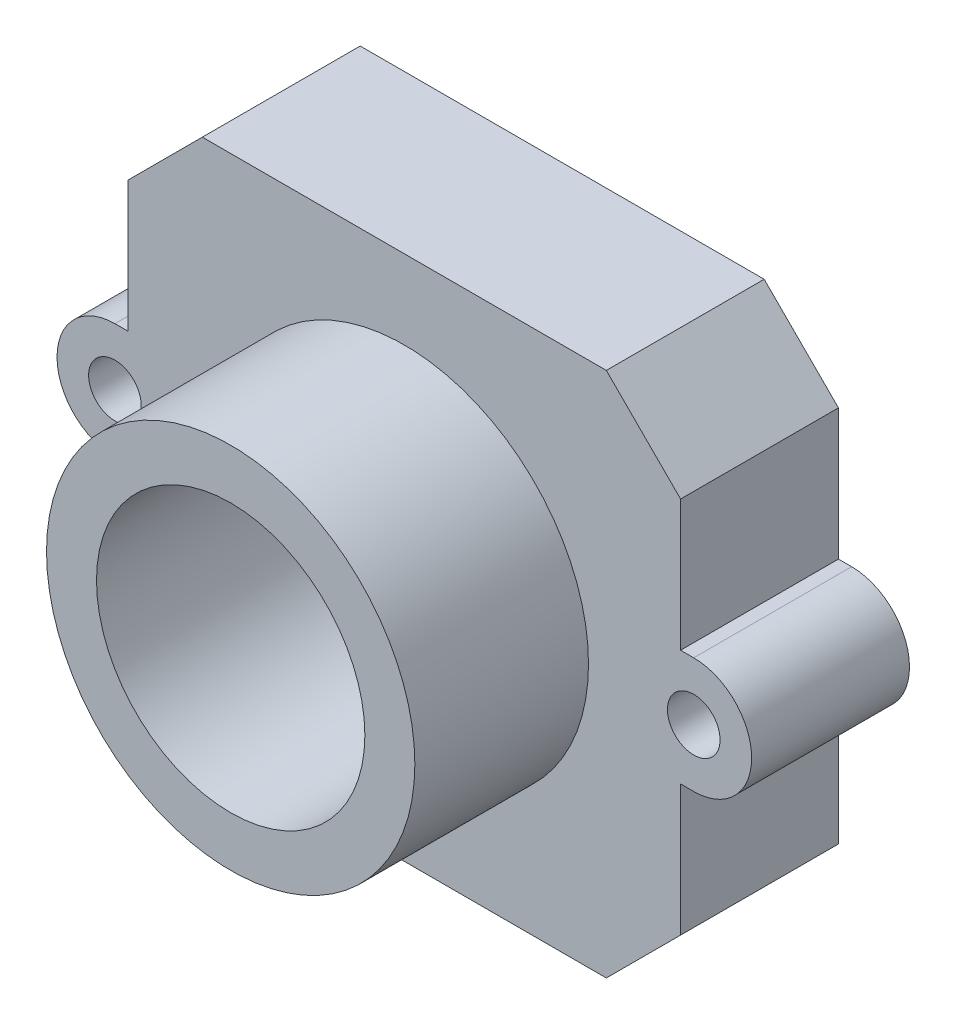
from build123d import *

# Parameters (mm, degrees)
SKETCH1_R                = 1
ROOF_DEPTH               = 1
WALLS_START              = -5
SKETCH1_3_R              = 1
WALLS_DEPTH              = 5
SKETCH2_R                = 5.1
SCREW_HOLE_IN_ROOF_DEPTH = 18.613631253
SCREW_START              = 6.6
SKETCH2_3_R              = 7
SKETCH2_3_R_2            = 5.1
SCREW_HOLDER_DEPTH       = 6.6


with BuildPart() as part:
    # Sketch1 → Roof (new body)
    with BuildSketch(Plane.XY):
        with BuildLine():
            Line((-7.67766953, 10), (-10.5, 7.17766953))
            Line((-10.5, 7.17766953), (-10.5, 2.2))
            Line((-10.5, 2.2), (-11.000000224, 2.2))
            ThreePointArc((-11.000000224, 2.2), (-13.200000224, 0), (-11.000000224, -2.2))
            Line((-11.000000224, -2.2), (-10.5, -2.2))
            Line((-10.5, -2.2), (-10.5, -7.17766953))
            Line((-10.5, -7.17766953), (-7.67766953, -10))
            Line((-7.67766953, -10), (7.67766953, -10))
            Line((7.67766953, -10), (10.5, -7.17766953))
            Line((10.5, -7.17766953), (10.5, -2.2))
            Line((10.5, -2.2), (11, -2.2))
            ThreePointArc((11, -2.2), (13.2, 0), (11, 2.2))
            Line((11, 2.2), (10.5, 2.2))
            Line((10.5, 2.2), (10.5, 7.17766953))
            Line((10.5, 7.17766953), (7.67766953, 10))
            Line((7.67766953, 10), (-7.67766953, 10))
        make_face()
        with Locations((11, 0)):
            Circle(SKETCH1_R, mode=Mode.SUBTRACT)
        with Locations((-11.000000224, 0)):
            Circle(SKETCH1_R, mode=Mode.SUBTRACT)
    extrude(amount=ROOF_DEPTH)

    # Sketch1<3> → Walls (add)
    with BuildSketch(Plane.XY.offset(WALLS_START)):
        with BuildLine():
            Line((-7.67766953, 10), (-10.5, 7.17766953))
            Line((-10.5, 7.17766953), (-10.5, 2.2))
            Line((-10.5, 2.2), (-11.000000224, 2.2))
            ThreePointArc((-11.000000224, 2.2), (-13.200000224, 0), (-11.000000224, -2.2))
            Line((-11.000000224, -2.2), (-10.5, -2.2))
            Line((-10.5, -2.2), (-10.5, -7.17766953))
            Line((-10.5, -7.17766953), (-7.67766953, -10))
            Line((-7.67766953, -10), (7.67766953, -10))
            Line((7.67766953, -10), (10.5, -7.17766953))
            Line((10.5, -7.17766953), (10.5, -2.2))
            Line((10.5, -2.2), (11, -2.2))
            ThreePointArc((11, -2.2), (13.2, 0), (11, 2.2))
            Line((11, 2.2), (10.5, 2.2))
            Line((10.5, 2.2), (10.5, 7.17766953))
            Line((10.5, 7.17766953), (7.67766953, 10))
            Line((7.67766953, 10), (-7.67766953, 10))
        make_face()
        with Locations((11, 0)):
            Circle(SKETCH1_3_R, mode=Mode.SUBTRACT)
        with Locations((-11.000000224, 0)):
            Circle(SKETCH1_3_R, mode=Mode.SUBTRACT)
        Polygon((-9, -6.556349186), (-9, 6.556349186), (-7.056349186, 8.5), (7.056349186, 8.5), (9, 6.556349186), (9, -6.556349186), (7.056349186, -8.5), (-7.056349186, -8.5), align=None, mode=Mode.SUBTRACT)
    extrude(amount=WALLS_DEPTH)

    # Sketch2 → Screw hole in roof (cut, through all)
    with BuildSketch(Plane.XY.offset(1)):
        Circle(SKETCH2_R)
    extrude(amount=-SCREW_HOLE_IN_ROOF_DEPTH, mode=Mode.SUBTRACT)

    # Sketch2<3> → Screw holder (add)
    with BuildSketch(Plane.XY.offset(1).offset(SCREW_START)):
        Circle(SKETCH2_3_R)
        Circle(SKETCH2_3_R_2, mode=Mode.SUBTRACT)
    extrude(amount=-SCREW_HOLDER_DEPTH)


solid = part.part
